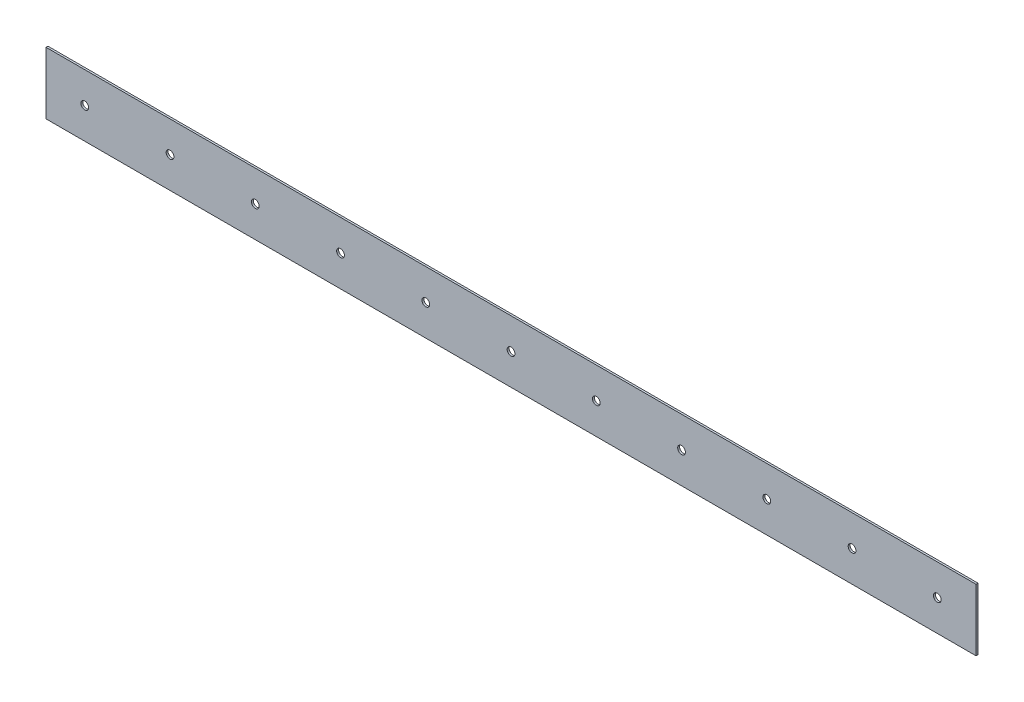
from build123d import *

# Parameters (mm, degrees)
SKETCH1_W           = 3048
SKETCH1_H           = 203.2
SKETCH1_R           = 12.7
BOSS_EXTRUDE1_DEPTH = 6.35


with BuildPart() as part:
    # Sketch1 → Boss-Extrude1 (new body)
    with BuildSketch(Plane.XY):
        Rectangle(SKETCH1_W, SKETCH1_H)
        with Locations((-1397, 0)):
            Circle(SKETCH1_R, mode=Mode.SUBTRACT)
        with Locations((-1117.6, 0)):
            Circle(SKETCH1_R, mode=Mode.SUBTRACT)
        with Locations((-838.2, 0)):
            Circle(SKETCH1_R, mode=Mode.SUBTRACT)
        with Locations((-558.8, 0)):
            Circle(SKETCH1_R, mode=Mode.SUBTRACT)
        with Locations((-279.4, 0)):
            Circle(SKETCH1_R, mode=Mode.SUBTRACT)
        Circle(SKETCH1_R, mode=Mode.SUBTRACT)
        with Locations((279.4, 0)):
            Circle(SKETCH1_R, mode=Mode.SUBTRACT)
        with Locations((558.8, 0)):
            Circle(SKETCH1_R, mode=Mode.SUBTRACT)
        with Locations((838.2, 0)):
            Circle(SKETCH1_R, mode=Mode.SUBTRACT)
        with Locations((1117.6, 0)):
            Circle(SKETCH1_R, mode=Mode.SUBTRACT)
        with Locations((1397, 0)):
            Circle(SKETCH1_R, mode=Mode.SUBTRACT)
    extrude(amount=BOSS_EXTRUDE1_DEPTH)


solid = part.part
